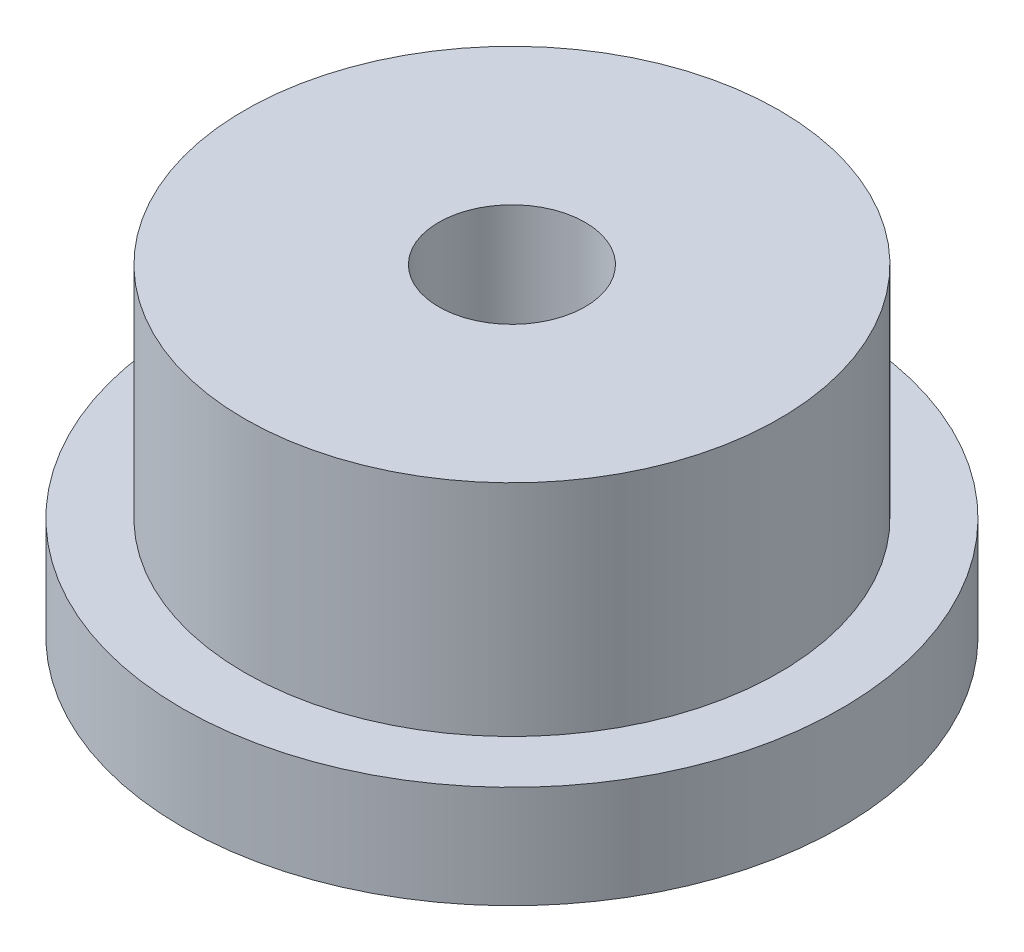
from build123d import *

# Parameters (mm, degrees)
SKETCH2_R           = 22.5
BOSS_EXTRUDE1_DEPTH = 7
SKETCH3_R           = 18.25
BOSS_EXTRUDE2_DEPTH = 15


with BuildPart() as part:
    # Sketch2 → Boss-Extrude1 (new body)
    with BuildSketch(Plane(origin=(0, 0, 0), x_dir=(1, 0, 0), z_dir=(0, 1, 0))):
        with Locations(Location((0, 0, 0), (0, 0, 270))):
            Circle(SKETCH2_R)
    extrude(amount=BOSS_EXTRUDE1_DEPTH)

    # Sketch3 → Boss-Extrude2 (add)
    with BuildSketch(Plane(origin=(0, 7, 0), x_dir=(1, 0, 0), z_dir=(0, 1, 0))):
        with Locations(Location((0, 0, 0), (0, 0, 270))):
            Circle(SKETCH3_R)
    extrude(amount=BOSS_EXTRUDE2_DEPTH)

    # Sketch5 → CBORE for M8 Hex Head Bolt1 (revolve, cut)
    with BuildSketch(Plane(origin=(0, 0, 0), x_dir=(0, 0, -1), z_dir=(1, 0, 0))):
        Polygon((0, 0), (0, 22), (5, 22), (5, 11.68), (9.005, 11.68), (9.005, 0.025), (9.03, 0), align=None)
    revolve(axis=Axis((0, -6.35, 0), (0, 1, 0)), mode=Mode.SUBTRACT)


solid = part.part
